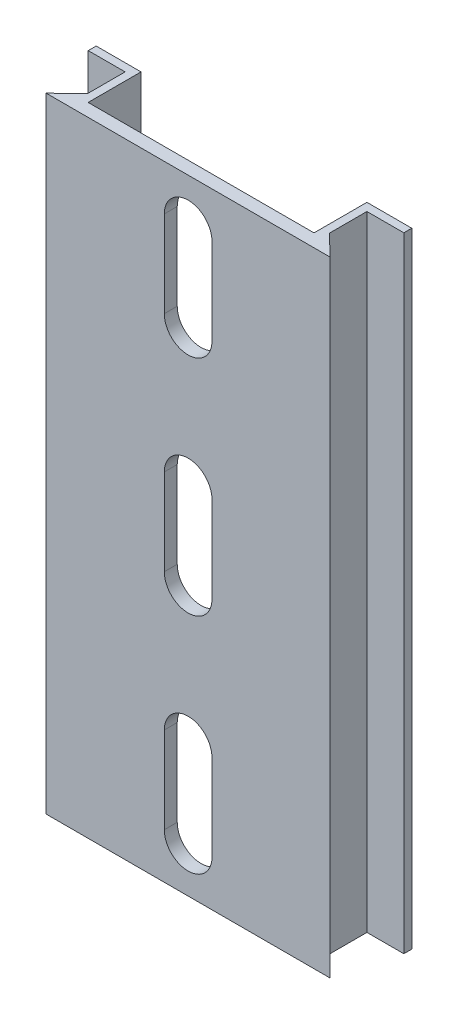
from build123d import *

# Parameters (mm, degrees)
BOSS_EXTRUDE1_DEPTH = 34.925
CUT_EXTRUDE1_DEPTH  = 40.820120417
LPATTERN1_COUNT     = 2
LPATTERN1_PITCH     = 25
LPATTERN1_COL_COUNT = 2
LPATTERN1_COL_PITCH = 25


with BuildPart() as part:
    # Sketch1 → Boss-Extrude1 (new, symmetric)
    with BuildSketch(Plane(origin=(0, 0, 0), x_dir=(1, 0, 0), z_dir=(0, 1, 0))):
        Polygon((-15.875, 0), (0, 0), (0, 1.4478), (-12.6365, 1.4478), (-12.6365, 7.366), (-17.653, 7.366), (-17.653, 6.477), (-13.5255, 6.477), (-13.5255, 2.286), align=None)
        Polygon((0, 1.4478), (0, 0), (15.875, 0), (13.5255, 2.286), (13.5255, 6.477), (17.653, 6.477), (17.653, 7.366), (12.6365, 7.366), (12.6365, 1.4478), align=None)
    extrude(amount=BOSS_EXTRUDE1_DEPTH, both=True)

    # Sketch2 → Cut-Extrude1 (cut, through all)
    with BuildSketch(Plane.XY):
        with BuildLine():
            Line((-2.667, -4.833), (-2.667, 4.833))
            ThreePointArc((-2.667, 4.833), (0, 7.5), (2.667, 4.833))
            Line((2.667, 4.833), (2.667, -4.833))
            ThreePointArc((2.667, -4.833), (0, -7.5), (-2.667, -4.833))
        make_face()
    cut_extrude1 = extrude(amount=-CUT_EXTRUDE1_DEPTH, mode=Mode.SUBTRACT)

    # LPattern1: Cut-Extrude1 ×2
    with Locations(*[(0, -i * LPATTERN1_PITCH, 0) for i in range(1, LPATTERN1_COUNT)]):
        add(cut_extrude1, mode=Mode.SUBTRACT)

    # LPattern1 col: Cut-Extrude1 ×2
    with Locations(*[(0, i * LPATTERN1_COL_PITCH, 0) for i in range(1, LPATTERN1_COL_COUNT)]):
        add(cut_extrude1, mode=Mode.SUBTRACT)


solid = part.part
